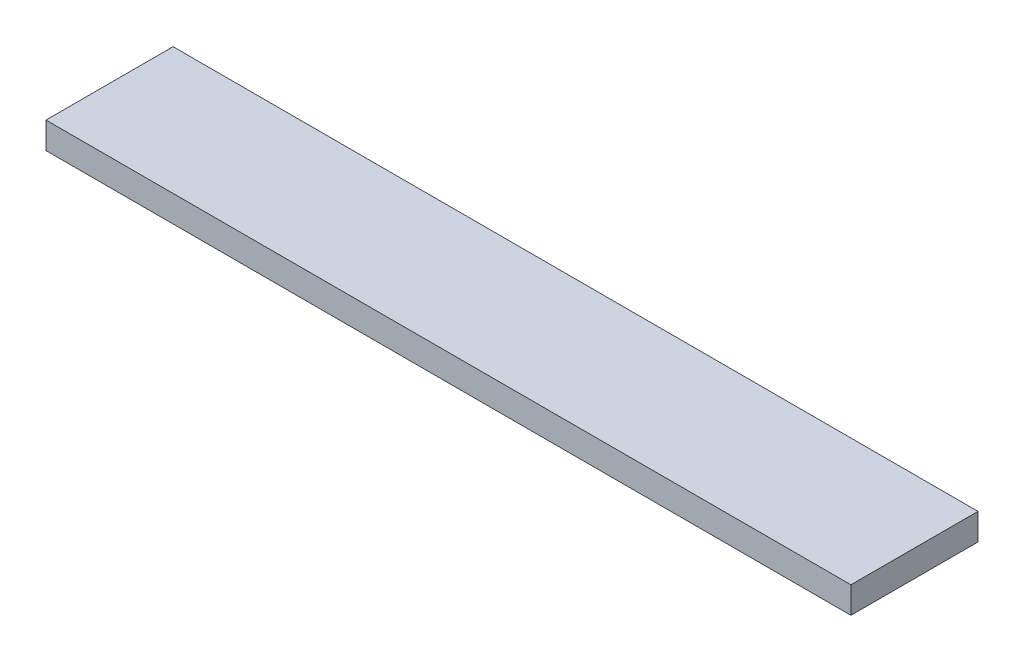
from build123d import *

# Parameters (mm, degrees)
SKETCH1_W           = 760
SKETCH1_H           = 120
BOSS_EXTRUDE1_DEPTH = 25


with BuildPart() as part:
    # Sketch1 → Boss-Extrude1 (new body)
    with BuildSketch(Plane(origin=(0, 0, 0), x_dir=(1, 0, 0), z_dir=(0, 1, 0))):
        Rectangle(SKETCH1_W, SKETCH1_H)
    extrude(amount=BOSS_EXTRUDE1_DEPTH)


solid = part.part
